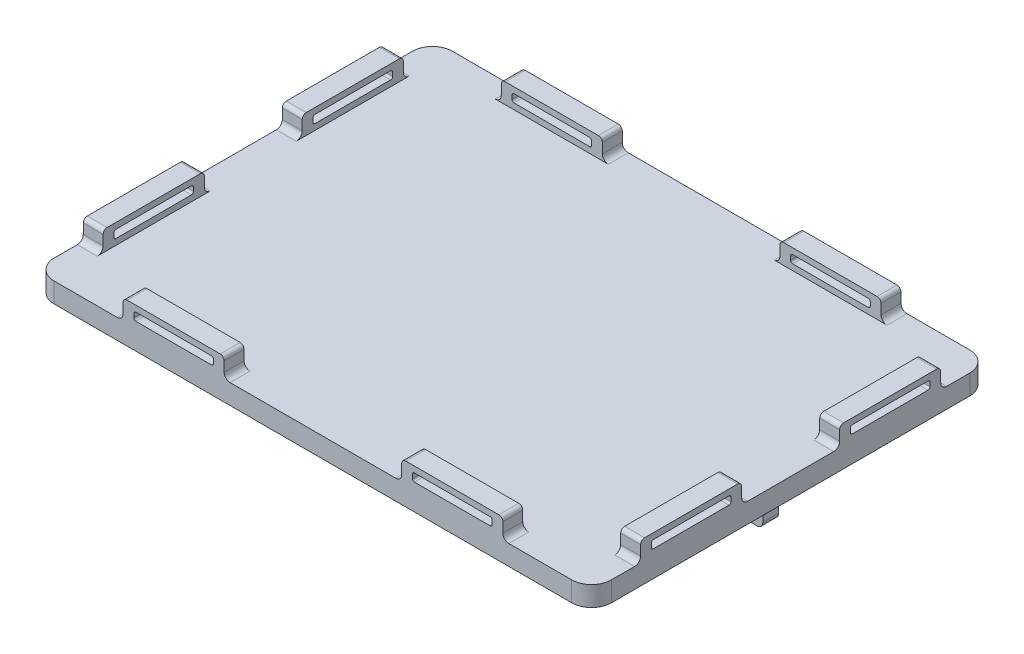
from build123d import *

# Parameters (mm, degrees)
BOSS_EXTRUDE1_DEPTH = 5
SKETCH2_W           = 4
SKETCH2_H           = 9
SKETCH2_W_2         = 9
SKETCH2_H_2         = 4
BOSS_EXTRUDE2_DEPTH = 15
SKETCH3_W           = 5
SKETCH3_H           = 25.4
SKETCH3_W_2         = 25.4
SKETCH3_H_2         = 5
BOSS_EXTRUDE3_DEPTH = 5
CUT_EXTRUDE1_DEPTH  = 173.699160392
CUT_EXTRUDE2_DEPTH  = 173.699160392
FILLET1_R           = 1
FILLET2_R           = 1.5
SKETCH6_R           = 1.55
CUT_EXTRUDE3_DEPTH  = 5
SKETCH7_R           = 1.55
CUT_EXTRUDE4_DEPTH  = 5
FILLET3_R           = 1.5
FILLET4_R           = 1.5


with BuildPart() as part:
    # Sketch1 → Boss-Extrude1 (new body)
    with BuildSketch(Plane(origin=(0, 0, 0), x_dir=(1, 0, 0), z_dir=(0, 1, 0))):
        with BuildLine():
            Line((5, 0), (135, 0))
            ThreePointArc((135, 0), (138.535533906, 1.464466094), (140, 5))
            Line((140, 5), (140, 95))
            ThreePointArc((140, 95), (138.535533906, 98.535533906), (135, 100))
            Line((135, 100), (5, 100))
            ThreePointArc((5, 100), (1.464466094, 98.535533906), (0, 95))
            Line((0, 95), (0, 5))
            ThreePointArc((0, 5), (1.464466094, 1.464466094), (5, 0))
        make_face()
    extrude(amount=BOSS_EXTRUDE1_DEPTH)

    # Sketch2 → Boss-Extrude2 (add)
    with BuildSketch(Plane.XZ):
        with Locations((14, -46.5)):
            Rectangle(SKETCH2_W, SKETCH2_H)
        with Locations((123.5, -57)):
            Rectangle(SKETCH2_W_2, SKETCH2_H_2)
    extrude(amount=BOSS_EXTRUDE2_DEPTH)

    # Sketch3 → Boss-Extrude3 (add)
    with BuildSketch(Plane(origin=(0, 5, 0), x_dir=(1, 0, 0), z_dir=(0, 1, 0))):
        with Locations((2.5, 75)):
            Rectangle(SKETCH3_W, SKETCH3_H)
        with Locations((2.5, 25)):
            Rectangle(SKETCH3_W, SKETCH3_H)
        with Locations((137.5, 75)):
            Rectangle(SKETCH3_W, SKETCH3_H)
        with Locations((137.5, 25)):
            Rectangle(SKETCH3_W, SKETCH3_H)
        with Locations((35, 97.5)):
            Rectangle(SKETCH3_W_2, SKETCH3_H_2)
        with Locations((105, 97.5)):
            Rectangle(SKETCH3_W_2, SKETCH3_H_2)
        with Locations((35, 2.5)):
            Rectangle(SKETCH3_W_2, SKETCH3_H_2)
        with Locations((105, 2.5)):
            Rectangle(SKETCH3_W_2, SKETCH3_H_2)
    extrude(amount=BOSS_EXTRUDE3_DEPTH)

    # Sketch4 → Cut-Extrude1 (cut, through all)
    with BuildSketch(Plane.ZY):
        with BuildLine():
            Line((-84.5, 8.5), (-65.5, 8.5))
            ThreePointArc((-65.5, 8.5), (-65.146446609, 8.353553391), (-65, 8))
            Line((-65, 8), (-65, 7))
            ThreePointArc((-65, 7), (-65.146446609, 6.646446609), (-65.5, 6.5))
            Line((-65.5, 6.5), (-84.5, 6.5))
            ThreePointArc((-84.5, 6.5), (-84.853553391, 6.646446609), (-85, 7))
            Line((-85, 7), (-85, 8))
            ThreePointArc((-85, 8), (-84.853553391, 8.353553391), (-84.5, 8.5))
        make_face()
        with BuildLine():
            Line((-34.5, 8.5), (-15.5, 8.5))
            ThreePointArc((-15.5, 8.5), (-15.146446609, 8.353553391), (-15, 8))
            Line((-15, 8), (-15, 7))
            ThreePointArc((-15, 7), (-15.146446609, 6.646446609), (-15.5, 6.5))
            Line((-15.5, 6.5), (-34.5, 6.5))
            ThreePointArc((-34.5, 6.5), (-34.853553391, 6.646446609), (-35, 7))
            Line((-35, 7), (-35, 8))
            ThreePointArc((-35, 8), (-34.853553391, 8.353553391), (-34.5, 8.5))
        make_face()
    extrude(amount=-CUT_EXTRUDE1_DEPTH, mode=Mode.SUBTRACT)

    # Sketch8 → Cut-Extrude2 (cut, through all)
    with BuildSketch(Plane.XY):
        with BuildLine():
            Line((25.5, 8.5), (44.5, 8.5))
            ThreePointArc((44.5, 8.5), (44.853553391, 8.353553391), (45, 8))
            Line((45, 8), (45, 7))
            ThreePointArc((45, 7), (44.853553391, 6.646446609), (44.5, 6.5))
            Line((44.5, 6.5), (25.5, 6.5))
            ThreePointArc((25.5, 6.5), (25.146446609, 6.646446609), (25, 7))
            Line((25, 7), (25, 8))
            ThreePointArc((25, 8), (25.146446609, 8.353553391), (25.5, 8.5))
        make_face()
        with BuildLine():
            Line((95.5, 8.5), (114.5, 8.5))
            ThreePointArc((114.5, 8.5), (114.853553391, 8.353553391), (115, 8))
            Line((115, 8), (115, 7))
            ThreePointArc((115, 7), (114.853553391, 6.646446609), (114.5, 6.5))
            Line((114.5, 6.5), (95.5, 6.5))
            ThreePointArc((95.5, 6.5), (95.146446609, 6.646446609), (95, 7))
            Line((95, 7), (95, 8))
            ThreePointArc((95, 8), (95.146446609, 8.353553391), (95.5, 8.5))
        make_face()
    extrude(amount=-CUT_EXTRUDE2_DEPTH, mode=Mode.SUBTRACT)

    # Fillet1
    fillet1_edges = [part.edges().sort_by_distance(p)[0] for p in [
        (92.3, 10, -97.5),
        (117.7, 10, -97.5),
        (22.3, 10, -2.5),
        (47.7, 10, -2.5),
        (92.3, 10, -2.5),
        (117.7, 10, -2.5),
        (2.5, 10, -62.3),
        (2.5, 10, -87.7),
        (137.5, 10, -87.7),
        (137.5, 10, -62.3),
        (2.5, 10, -12.3),
        (2.5, 10, -37.7),
        (137.5, 10, -37.7),
        (137.5, 10, -12.3),
        (22.3, 10, -97.5),
        (47.7, 10, -97.5),
    ]]
    fillet(fillet1_edges, radius=FILLET1_R)

    # Fillet2
    fillet2_edges = [part.edges().sort_by_distance(p)[0] for p in [
        (92.3, 5, -97.5),
        (117.7, 5, -97.5),
        (22.3, 5, -2.5),
        (47.7, 5, -2.5),
        (92.3, 5, -2.5),
        (117.7, 5, -2.5),
        (2.5, 5, -62.3),
        (2.5, 5, -87.7),
        (137.5, 5, -87.7),
        (137.5, 5, -62.3),
        (2.5, 5, -12.3),
        (2.5, 5, -37.7),
        (137.5, 5, -37.7),
        (137.5, 5, -12.3),
        (22.3, 5, -97.5),
        (47.7, 5, -97.5),
    ]]
    fillet(fillet2_edges, radius=FILLET2_R)

    # Sketch6 → Cut-Extrude3 (cut)
    with BuildSketch(Plane.ZY.offset(-12)):
        with Locations((-46.5, -11)):
            Circle(SKETCH6_R)
    extrude(amount=-CUT_EXTRUDE3_DEPTH, mode=Mode.SUBTRACT)

    # Sketch7 → Cut-Extrude4 (cut)
    with BuildSketch(Plane.XY.offset(-55)):
        with Locations((123.5, -11)):
            Circle(SKETCH7_R)
    extrude(amount=-CUT_EXTRUDE4_DEPTH, mode=Mode.SUBTRACT)

    # Fillet3
    fillet3_edges = [part.edges().sort_by_distance(p)[0] for p in [
        (14, -15, -51),
        (14, -15, -42),
        (119, -15, -57),
        (128, -15, -57),
    ]]
    fillet(fillet3_edges, radius=FILLET3_R)

    # Fillet4
    fillet4_edges = [part.edges().sort_by_distance(p)[0] for p in [
        (14, 0, -51),
        (14, 0, -42),
        (119, 0, -57),
        (128, 0, -57),
    ]]
    fillet(fillet4_edges, radius=FILLET4_R)


solid = part.part
